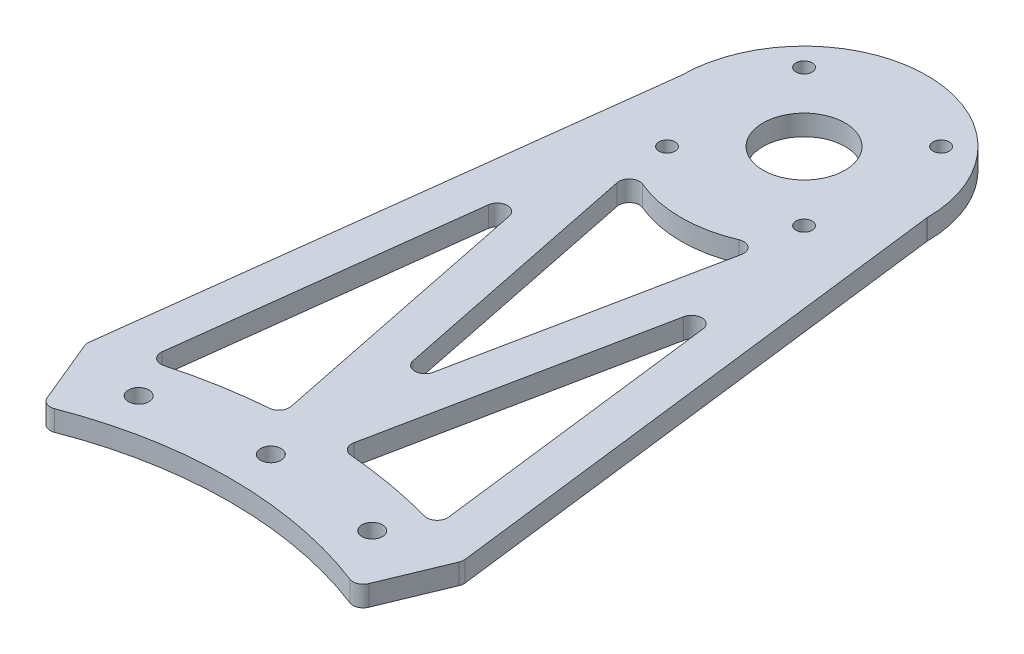
from build123d import *

# Parameters (mm, degrees)
SKETCH1_R           = 1.25
SKETCH1_R_2         = 1.5875
SKETCH1_R_3         = 6.35
SKETCH1_R_4         = 1.587499999
BOSS_EXTRUDE1_DEPTH = 3.175


with BuildPart() as part:
    # Sketch1 → Boss-Extrude1 (new body)
    with BuildSketch(Plane(origin=(0, 0, 0), x_dir=(1, 0, 0), z_dir=(0, 1, 0))):
        with BuildLine():
            Line((-19.061691445, 152.305177286), (-29.109279467, 70.814859111))
            ThreePointArc((-29.109279467, 70.814859111), (-29.106764186, 70.406916612), (-29.000369251, 70.01308476))
            Line((-29.000369251, 70.01308476), (-24.900498144, 60.115120329))
            ThreePointArc((-24.900498144, 60.115120329), (-24.059191565, 59.263489811), (-22.862282328, 59.241590515))
            ThreePointArc((-22.862282328, 59.241590515), (0, 63.5), (22.862282328, 59.241590515))
            ThreePointArc((22.862282328, 59.241590515), (24.059191565, 59.263489811), (24.900498144, 60.115120329))
            Line((24.900498144, 60.115120329), (29.000369251, 70.01308476))
            ThreePointArc((29.000369251, 70.01308476), (29.106764186, 70.406916612), (29.109279467, 70.814859111))
            Line((29.109279467, 70.814859111), (19.061691445, 152.305177286))
            ThreePointArc((19.061691445, 152.305177286), (19.052985039, 152.398309253), (19.049778848, 152.491792328))
            ThreePointArc((19.049778848, 152.491792328), (0, 171.45), (-19.049778848, 152.491792328))
            ThreePointArc((-19.049778848, 152.491792328), (-19.052985039, 152.398309253), (-19.061691445, 152.305177286))
        make_face()
        with Locations(Location((-10.606601718, 163.006601718, 0), (0, 0, 270))):
            Circle(SKETCH1_R, mode=Mode.SUBTRACT)
        with Locations(Location((0, 69.85, 0), (0, 0, 270))):
            Circle(SKETCH1_R_2, mode=Mode.SUBTRACT)
        with Locations(Location((18.0785103, 67.469918962, 0), (0, 0, 270))):
            Circle(SKETCH1_R_2, mode=Mode.SUBTRACT)
        with Locations(Location((10.606601718, 163.006601718, 0), (0, 0, 270))):
            Circle(SKETCH1_R, mode=Mode.SUBTRACT)
        with Locations(Location((10.606601718, 141.793398282, 0), (0, 0, 270))):
            Circle(SKETCH1_R, mode=Mode.SUBTRACT)
        with Locations(Location((0, 152.4, 0), (0, 0, 270))):
            Circle(SKETCH1_R_3, mode=Mode.SUBTRACT)
        with Locations(Location((-10.606601718, 141.793398282, 0), (0, 0, 270))):
            Circle(SKETCH1_R, mode=Mode.SUBTRACT)
        with Locations(Location((-18.078510302, 67.469918971, 0), (0, 0, 270))):
            Circle(SKETCH1_R_4, mode=Mode.SUBTRACT)
        with BuildLine():
            Line((-13.497810395, 120.266290898), (-4.865408959, 77.838541906))
            ThreePointArc((-4.865408959, 77.838541906), (-5.15124286, 76.569257194), (-6.289995152, 75.939949704))
            ThreePointArc((-6.289995152, 75.939949704), (-13.288948331, 75.032285399), (-20.173905346, 73.480974021))
            ThreePointArc((-20.173905346, 73.480974021), (-21.632306598, 73.810794489), (-22.169764015, 75.206092049))
            Line((-22.169764015, 75.206092049), (-16.629007128, 120.144045384))
            ThreePointArc((-16.629007128, 120.144045384), (-15.115368796, 121.53607252), (-13.497810395, 120.266290898))
        make_face(mode=Mode.SUBTRACT)
        with BuildLine():
            Line((-9.626782179, 133.089731304), (-1.555627758, 93.42047862))
            ThreePointArc((-1.555627758, 93.42047862), (0, 92.149488537), (1.555627758, 93.42047862))
            Line((1.555627758, 93.42047862), (9.626782179, 133.089731304))
            ThreePointArc((9.626782179, 133.089731304), (9.075338598, 134.635781943), (7.450296388, 134.867299588))
            ThreePointArc((7.450296388, 134.867299588), (0, 133.35), (-7.450296388, 134.867299588))
            ThreePointArc((-7.450296388, 134.867299588), (-9.075338598, 134.635781943), (-9.626782179, 133.089731304))
        make_face(mode=Mode.SUBTRACT)
        with BuildLine():
            Line((4.865408959, 77.838541906), (13.497810395, 120.266290898))
            ThreePointArc((13.497810395, 120.266290898), (15.115368796, 121.53607252), (16.629007128, 120.144045384))
            Line((16.629007128, 120.144045384), (22.169764015, 75.206092049))
            ThreePointArc((22.169764015, 75.206092049), (21.632306598, 73.810794489), (20.173905346, 73.480974021))
            ThreePointArc((20.173905346, 73.480974021), (13.288948331, 75.032285399), (6.289995152, 75.939949704))
            ThreePointArc((6.289995152, 75.939949704), (5.15124286, 76.569257194), (4.865408959, 77.838541906))
        make_face(mode=Mode.SUBTRACT)
    extrude(amount=BOSS_EXTRUDE1_DEPTH)


solid = part.part
